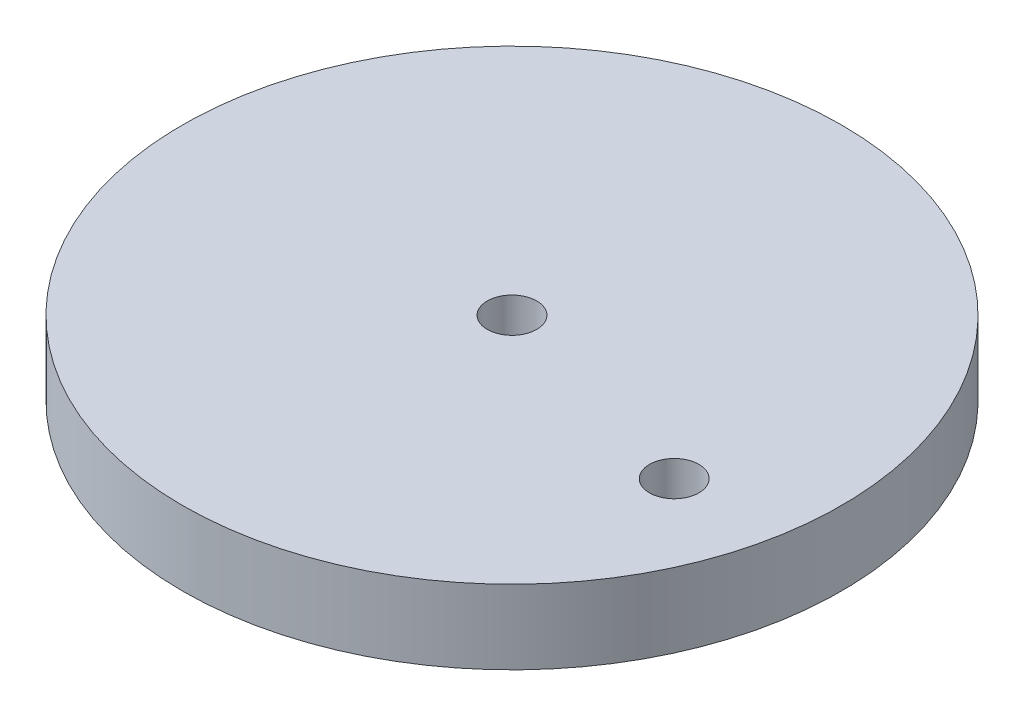
from build123d import *

# Parameters (mm, degrees)
SKETCH1_R           = 20
SKETCH1_R_2         = 1.5
BOSS_EXTRUDE1_DEPTH = 2.25


with BuildPart() as part:
    # Sketch1 → Boss-Extrude1 (new, symmetric)
    with BuildSketch(Plane(origin=(0, 0, 0), x_dir=(1, 0, 0), z_dir=(0, 1, 0))):
        with Locations(Location((0, 0, 0), (0, 0, 270))):
            Circle(SKETCH1_R)
        with Locations(Location((0, 0, 0), (0, 0, 270))):
            Circle(SKETCH1_R_2, mode=Mode.SUBTRACT)
        with Locations(Location((13.5109196, -3.668112808, 0), (0, 0, 270))):
            Circle(SKETCH1_R_2, mode=Mode.SUBTRACT)
    extrude(amount=BOSS_EXTRUDE1_DEPTH, both=True)


solid = part.part
